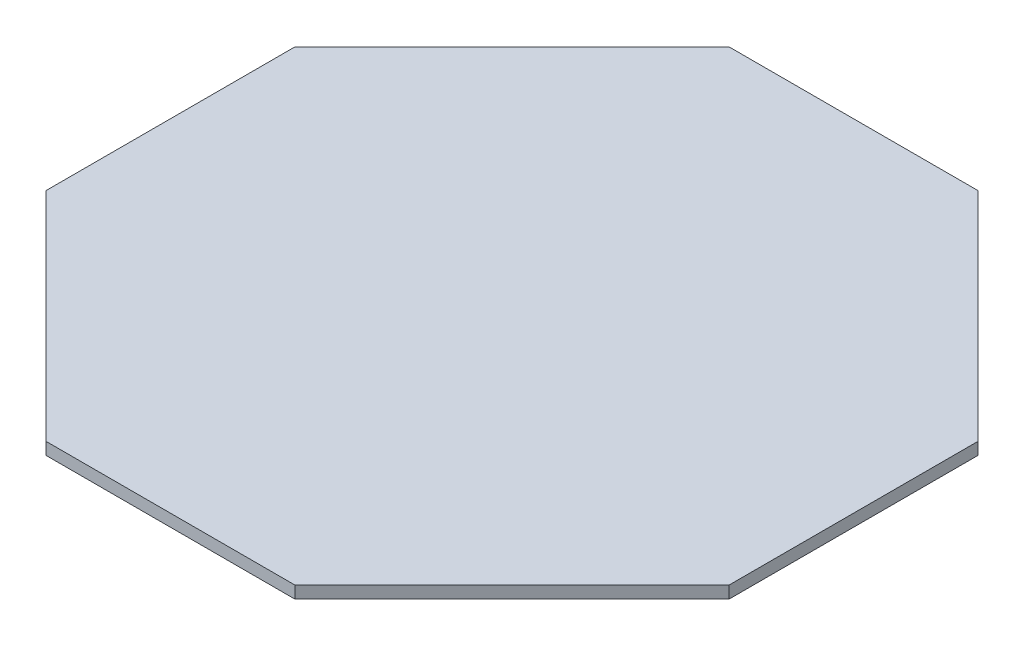
from build123d import *

# Parameters (mm, degrees)
BOSS_EXTRUDE1_DEPTH = 5
SCALE1_SCALE        = 0.15


with BuildPart() as part:
    # Sketch3 → Boss-Extrude1 (new body)
    with BuildSketch(Plane(origin=(0, 0, 0), x_dir=(1, 0, 0), z_dir=(0, 1, 0))):
        Polygon((-612.771529665, 336.297556136), (-510.771529665, 336.297556136), (-421.771529665, 247.297556136), (-421.771529665, 145.297556136), (-510.771529665, 56.297556136), (-612.771529665, 56.297556136), (-701.771529665, 145.297556136), (-701.771529665, 247.297556136), align=None)
    extrude(amount=BOSS_EXTRUDE1_DEPTH)


with BuildPart() as part_1:
    # Scale1: scaled about (-561.771529665, 2.5, -196.297556136)
    add(part.part.scale(SCALE1_SCALE).moved(Location((-477.505800215, 2.125, -166.852922716))))


solid = part_1.part
